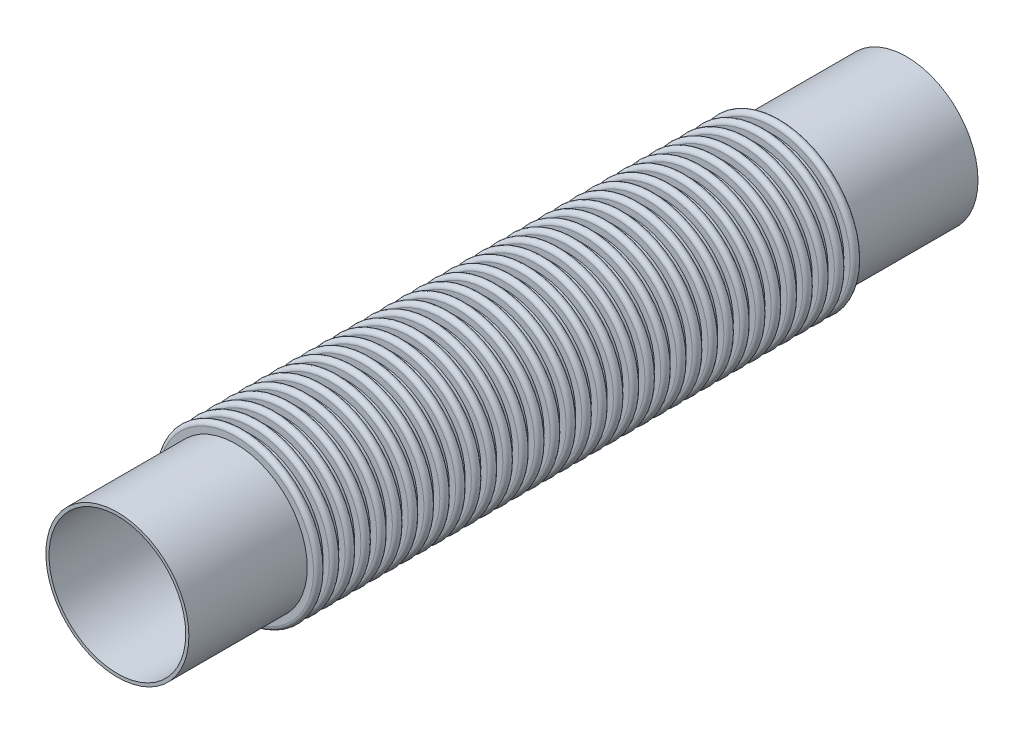
from build123d import *


with BuildPart() as part:
    # Sketch1 → Revolve1 (revolve)
    with BuildSketch(Plane(origin=(0, 0, 0), x_dir=(0, 0, -1), z_dir=(1, 0, 0))):
        with BuildLine():
            Line((-63.5, 11.508), (-63.5, 11))
            Line((-63.5, 11), (-44.45, 11))
            Line((-44.45, 11), (44.45, 11))
            Line((44.45, 11), (63.5, 11))
            Line((63.5, 11), (63.5, 11.508))
            Line((63.5, 11.508), (44.45, 11.508))
            Line((44.45, 11.508), (43.18, 11.508))
            Line((43.18, 11.508), (43.18, 12.524))
            ThreePointArc((43.18, 12.524), (42.545, 13.159), (41.91, 12.524))
            Line((41.91, 12.524), (41.91, 11.508))
            Line((41.91, 11.508), (40.64, 11.508))
            Line((40.64, 11.508), (40.64, 12.524))
            ThreePointArc((40.64, 12.524), (40.005, 13.159), (39.37, 12.524))
            Line((39.37, 12.524), (39.37, 11.508))
            Line((39.37, 11.508), (38.1, 11.508))
            Line((38.1, 11.508), (38.1, 12.524))
            ThreePointArc((38.1, 12.524), (37.465, 13.159), (36.83, 12.524))
            Line((36.83, 12.524), (36.83, 11.508))
            Line((36.83, 11.508), (35.56, 11.508))
            Line((35.56, 11.508), (35.56, 12.524))
            ThreePointArc((35.56, 12.524), (34.925, 13.159), (34.29, 12.524))
            Line((34.29, 12.524), (34.29, 11.508))
            Line((34.29, 11.508), (33.02, 11.508))
            Line((33.02, 11.508), (33.02, 12.524))
            ThreePointArc((33.02, 12.524), (32.385, 13.159), (31.75, 12.524))
            Line((31.75, 12.524), (31.75, 11.508))
            Line((31.75, 11.508), (30.48, 11.508))
            Line((30.48, 11.508), (30.48, 12.524))
            ThreePointArc((30.48, 12.524), (29.845, 13.159), (29.21, 12.524))
            Line((29.21, 12.524), (29.21, 11.508))
            Line((29.21, 11.508), (27.94, 11.508))
            Line((27.94, 11.508), (27.94, 12.524))
            ThreePointArc((27.94, 12.524), (27.305, 13.159), (26.67, 12.524))
            Line((26.67, 12.524), (26.67, 11.508))
            Line((26.67, 11.508), (25.4, 11.508))
            Line((25.4, 11.508), (25.4, 12.524))
            ThreePointArc((25.4, 12.524), (24.765, 13.159), (24.13, 12.524))
            Line((24.13, 12.524), (24.13, 11.508))
            Line((24.13, 11.508), (22.86, 11.508))
            Line((22.86, 11.508), (22.86, 12.524))
            ThreePointArc((22.86, 12.524), (22.225, 13.159), (21.59, 12.524))
            Line((21.59, 12.524), (21.59, 11.508))
            Line((21.59, 11.508), (20.32, 11.508))
            Line((20.32, 11.508), (20.32, 12.524))
            ThreePointArc((20.32, 12.524), (19.685, 13.159), (19.05, 12.524))
            Line((19.05, 12.524), (19.05, 11.508))
            Line((19.05, 11.508), (17.78, 11.508))
            Line((17.78, 11.508), (17.78, 12.524))
            ThreePointArc((17.78, 12.524), (17.145, 13.159), (16.51, 12.524))
            Line((16.51, 12.524), (16.51, 11.508))
            Line((16.51, 11.508), (15.24, 11.508))
            Line((15.24, 11.508), (15.24, 12.524))
            ThreePointArc((15.24, 12.524), (14.605, 13.159), (13.97, 12.524))
            Line((13.97, 12.524), (13.97, 11.508))
            Line((13.97, 11.508), (12.7, 11.508))
            Line((12.7, 11.508), (12.7, 12.524))
            ThreePointArc((12.7, 12.524), (12.065, 13.159), (11.43, 12.524))
            Line((11.43, 12.524), (11.43, 11.508))
            Line((11.43, 11.508), (10.16, 11.508))
            Line((10.16, 11.508), (10.16, 12.524))
            ThreePointArc((10.16, 12.524), (9.525, 13.159), (8.89, 12.524))
            Line((8.89, 12.524), (8.89, 11.508))
            Line((8.89, 11.508), (7.62, 11.508))
            Line((7.62, 11.508), (7.62, 12.524))
            ThreePointArc((7.62, 12.524), (6.985, 13.159), (6.35, 12.524))
            Line((6.35, 12.524), (6.35, 11.508))
            Line((6.35, 11.508), (5.08, 11.508))
            Line((5.08, 11.508), (5.08, 12.524))
            ThreePointArc((5.08, 12.524), (4.445, 13.159), (3.81, 12.524))
            Line((3.81, 12.524), (3.81, 11.508))
            Line((3.81, 11.508), (2.54, 11.508))
            Line((2.54, 11.508), (2.54, 12.524))
            ThreePointArc((2.54, 12.524), (1.905, 13.159), (1.27, 12.524))
            Line((1.27, 12.524), (1.27, 11.508))
            Line((1.27, 11.508), (0, 11.508))
            Line((0, 11.508), (0, 12.524))
            ThreePointArc((0, 12.524), (-0.635, 13.159), (-1.27, 12.524))
            Line((-1.27, 12.524), (-1.27, 11.508))
            Line((-1.27, 11.508), (-2.54, 11.508))
            Line((-2.54, 11.508), (-2.54, 12.524))
            ThreePointArc((-2.54, 12.524), (-3.175, 13.159), (-3.81, 12.524))
            Line((-3.81, 12.524), (-3.81, 11.508))
            Line((-3.81, 11.508), (-5.08, 11.508))
            Line((-5.08, 11.508), (-5.08, 12.524))
            ThreePointArc((-5.08, 12.524), (-5.715, 13.159), (-6.35, 12.524))
            Line((-6.35, 12.524), (-6.35, 11.508))
            Line((-6.35, 11.508), (-7.62, 11.508))
            Line((-7.62, 11.508), (-7.62, 12.524))
            ThreePointArc((-7.62, 12.524), (-8.255, 13.159), (-8.89, 12.524))
            Line((-8.89, 12.524), (-8.89, 11.508))
            Line((-8.89, 11.508), (-10.16, 11.508))
            Line((-10.16, 11.508), (-10.16, 12.524))
            ThreePointArc((-10.16, 12.524), (-10.795, 13.159), (-11.43, 12.524))
            Line((-11.43, 12.524), (-11.43, 11.508))
            Line((-11.43, 11.508), (-12.7, 11.508))
            Line((-12.7, 11.508), (-12.7, 12.524))
            ThreePointArc((-12.7, 12.524), (-13.335, 13.159), (-13.97, 12.524))
            Line((-13.97, 12.524), (-13.97, 11.508))
            Line((-13.97, 11.508), (-15.24, 11.508))
            Line((-15.24, 11.508), (-15.24, 12.524))
            ThreePointArc((-15.24, 12.524), (-15.875, 13.159), (-16.51, 12.524))
            Line((-16.51, 12.524), (-16.51, 11.508))
            Line((-16.51, 11.508), (-17.78, 11.508))
            Line((-17.78, 11.508), (-17.78, 12.524))
            ThreePointArc((-17.78, 12.524), (-18.415, 13.159), (-19.05, 12.524))
            Line((-19.05, 12.524), (-19.05, 11.508))
            Line((-19.05, 11.508), (-20.32, 11.508))
            Line((-20.32, 11.508), (-20.32, 12.524))
            ThreePointArc((-20.32, 12.524), (-20.955, 13.159), (-21.59, 12.524))
            Line((-21.59, 12.524), (-21.59, 11.508))
            Line((-21.59, 11.508), (-22.86, 11.508))
            Line((-22.86, 11.508), (-22.86, 12.524))
            ThreePointArc((-22.86, 12.524), (-23.495, 13.159), (-24.13, 12.524))
            Line((-24.13, 12.524), (-24.13, 11.508))
            Line((-24.13, 11.508), (-25.4, 11.508))
            Line((-25.4, 11.508), (-25.4, 12.524))
            ThreePointArc((-25.4, 12.524), (-26.035, 13.159), (-26.67, 12.524))
            Line((-26.67, 12.524), (-26.67, 11.508))
            Line((-26.67, 11.508), (-27.94, 11.508))
            Line((-27.94, 11.508), (-27.94, 12.524))
            ThreePointArc((-27.94, 12.524), (-28.575, 13.159), (-29.21, 12.524))
            Line((-29.21, 12.524), (-29.21, 11.508))
            Line((-29.21, 11.508), (-30.48, 11.508))
            Line((-30.48, 11.508), (-30.48, 12.524))
            ThreePointArc((-30.48, 12.524), (-31.115, 13.159), (-31.75, 12.524))
            Line((-31.75, 12.524), (-31.75, 11.508))
            Line((-31.75, 11.508), (-33.02, 11.508))
            Line((-33.02, 11.508), (-33.02, 12.524))
            ThreePointArc((-33.02, 12.524), (-33.655, 13.159), (-34.29, 12.524))
            Line((-34.29, 12.524), (-34.29, 11.508))
            Line((-34.29, 11.508), (-35.56, 11.508))
            Line((-35.56, 11.508), (-35.56, 12.524))
            ThreePointArc((-35.56, 12.524), (-36.195, 13.159), (-36.83, 12.524))
            Line((-36.83, 12.524), (-36.83, 11.508))
            Line((-36.83, 11.508), (-38.1, 11.508))
            Line((-38.1, 11.508), (-38.1, 12.524))
            ThreePointArc((-38.1, 12.524), (-38.735, 13.159), (-39.37, 12.524))
            Line((-39.37, 12.524), (-39.37, 11.508))
            Line((-39.37, 11.508), (-40.64, 11.508))
            Line((-40.64, 11.508), (-40.64, 12.524))
            ThreePointArc((-40.64, 12.524), (-41.275, 13.159), (-41.91, 12.524))
            Line((-41.91, 12.524), (-41.91, 11.508))
            Line((-41.91, 11.508), (-43.18, 11.508))
            Line((-43.18, 11.508), (-43.18, 12.524))
            ThreePointArc((-43.18, 12.524), (-43.815, 13.159), (-44.45, 12.524))
            Line((-44.45, 12.524), (-44.45, 11.508))
            Line((-44.45, 11.508), (-63.5, 11.508))
        make_face()
    revolve(axis=Axis((0, 0, 63.5), (0, 0, -1)))


solid = part.part
